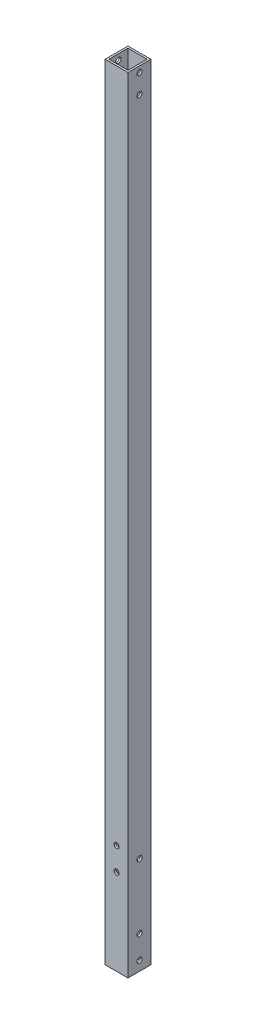
from build123d import *

# Parameters (mm, degrees)
SKETCH_1_W          = 12
SKETCH_1_H          = 12
SKETCH_1_W_2        = 10
SKETCH_1_H_2        = 10
EXTRUDE_1_DEPTH     = 410
SKETCH_2_R          = 1.35
CUT_EXTRUDE_1_DEPTH = 411.219453464
SKETCH_3_R          = 1.35
CUT_EXTRUDE_2_DEPTH = 411.219453464
SKETCH_4_R          = 1.35
CUT_EXTRUDE_3_DEPTH = 411.219453464


with BuildPart() as part:
    # 草图1 → 凸台-拉伸1 (new body)
    with BuildSketch(Plane(origin=(0, 0, 0), x_dir=(1, 0, 0), z_dir=(0, 1, 0))):
        Rectangle(SKETCH_1_W, SKETCH_1_H)
        Rectangle(SKETCH_1_W_2, SKETCH_1_H_2, mode=Mode.SUBTRACT)
    extrude(amount=EXTRUDE_1_DEPTH)

    # 草图2 → 切除-拉伸1 (cut, through all)
    with BuildSketch(Plane(origin=(6, 0, 0), x_dir=(0, 0, -1), z_dir=(1, 0, 0))):
        with Locations((0, 5)):
            Circle(SKETCH_2_R)
        with Locations((0, 17)):
            Circle(SKETCH_2_R)
        with Locations((0, 51)):
            Circle(SKETCH_2_R)
    extrude(amount=-CUT_EXTRUDE_1_DEPTH, mode=Mode.SUBTRACT)

    # 草图3 → 切除-拉伸2 (cut, through all)
    with BuildSketch(Plane(origin=(6, 0, 0), x_dir=(0, 0, -1), z_dir=(1, 0, 0))):
        with Locations((0, 407)):
            Circle(SKETCH_3_R)
        with Locations((0, 397)):
            Circle(SKETCH_3_R)
    extrude(amount=-CUT_EXTRUDE_2_DEPTH, mode=Mode.SUBTRACT)

    # 草图4 → 切除-拉伸3 (cut, through all)
    with BuildSketch(Plane(origin=(0, 0, -6), x_dir=(-1, 0, 0), z_dir=(0, 0, -1))):
        with Locations((0, 45)):
            Circle(SKETCH_4_R)
        with Locations((0, 57)):
            Circle(SKETCH_4_R)
    extrude(amount=-CUT_EXTRUDE_3_DEPTH, mode=Mode.SUBTRACT)


solid = part.part
